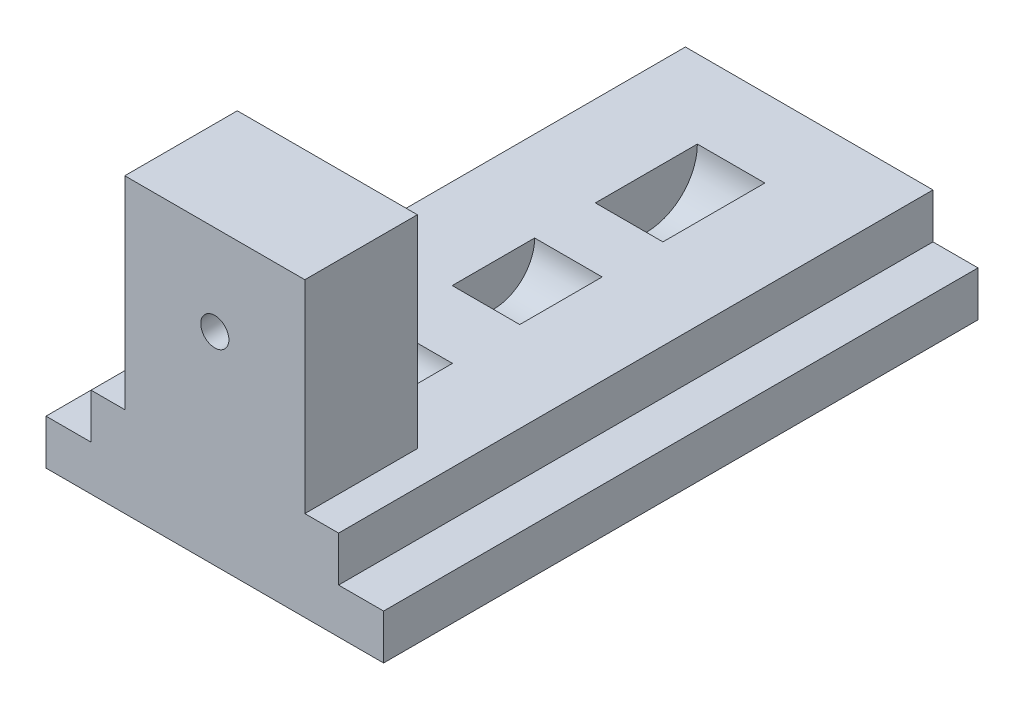
from build123d import *

# Parameters (mm, degrees)
EXTRUDE_1_DEPTH     = 6
EXTRUDE_2_DEPTH     = 52.819277108
EXTRUDE_3_DEPTH     = 52.819277108
SKETCH_6_W          = 16
SKETCH_6_H          = 10
EXTRUDE_5_DEPTH     = 18
SKETCH_7_R          = 1.25
CUT_EXTRUDE_2_DEPTH = 10


with BuildPart() as part:
    # Эскиз1 → Бобышка-Вытянуть1 (new body)
    with BuildSketch(Plane(origin=(0, 0, 0), x_dir=(0, 0, -1), z_dir=(1, 0, 0))):
        with BuildLine():
            Line((0, 0), (52.819277108, 0))
            Line((52.819277108, 0), (52.819277108, 8))
            Line((52.819277108, 8), (45.879518072, 8))
            ThreePointArc((45.879518072, 8), (41.34939759, 3.469879518), (36.819277108, 8))
            Line((36.819277108, 8), (31.421686747, 8))
            ThreePointArc((31.421686747, 8), (27.759036145, 4.337349398), (24.096385542, 8))
            Line((24.096385542, 8), (18.120481928, 8))
            ThreePointArc((18.120481928, 8), (15.036144578, 4.915662651), (11.951807229, 8))
            Line((11.951807229, 8), (0, 8))
            Line((0, 8), (0, 0))
        make_face()
    extrude(amount=EXTRUDE_1_DEPTH)

    # Эскиз2 → Бобышка-Вытянуть2 (add)
    with BuildSketch(Plane.XY):
        Polygon((6, 8), (14, 8), (14, 4), (18, 4), (18, 0), (6, 0), align=None)
    extrude(amount=-EXTRUDE_2_DEPTH)

    # Эскиз3 → Бобышка-Вытянуть3 (add)
    with BuildSketch(Plane.XY):
        Polygon((0, 8), (-8, 8), (-8, 4), (-12, 4), (-12, 0), (0, 0), align=None)
    extrude(amount=-EXTRUDE_3_DEPTH)

    # Эскиз6 → Бобышка-Вытянуть5 (add)
    with BuildSketch(Plane(origin=(0, 8, 0), x_dir=(1, 0, 0), z_dir=(0, 1, 0))):
        with Locations((3, 5)):
            Rectangle(SKETCH_6_W, SKETCH_6_H)
    extrude(amount=EXTRUDE_5_DEPTH)

    # Эскиз7 → Вырез-Вытянуть2 (cut)
    with BuildSketch(Plane.XY):
        with Locations((3, 18)):
            Circle(SKETCH_7_R)
    extrude(amount=-CUT_EXTRUDE_2_DEPTH, mode=Mode.SUBTRACT)


solid = part.part
